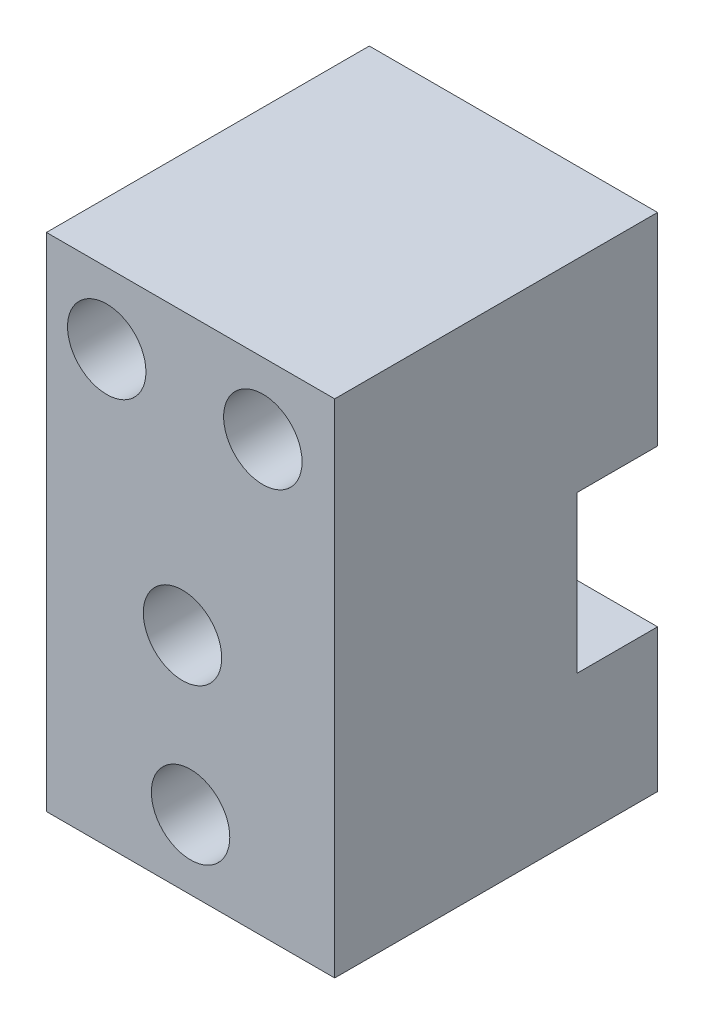
from build123d import *

# Parameters (mm, degrees)
ESQUISSE1_W             = 12.5
ESQUISSE1_H             = 21.75
BOSS_EXTRU_3_DEPTH      = 14
ESQUISSE9_W             = 10.579409941
ESQUISSE9_H             = 6.787962443
ENL_V_MAT_EXTRU_7_DEPTH = 3.5
D_GAGEMENT_M32_D        = 3.4
D_GAGEMENT_M33_D        = 3.4
ESQUISSE23_W            = 9.88556754
ESQUISSE23_H            = 6.787962443
ESQUISSE23_R            = 1.7
BOSS_EXTRU_4_DEPTH      = 3.5


with BuildPart() as part:
    # Esquisse1 → Boss.-Extru.3 (new body)
    with BuildSketch(Plane.XY):
        Rectangle(ESQUISSE1_W, ESQUISSE1_H)
    extrude(amount=BOSS_EXTRU_3_DEPTH)

    # Esquisse9 → Enlèv. mat.-Extru.7 (cut)
    with BuildSketch(Plane.XY.offset(14)):
        with Locations((1.654137431, -1.292305661)):
            Rectangle(ESQUISSE9_W, ESQUISSE9_H)
    enl_v_mat_extru_7 = extrude(amount=-ENL_V_MAT_EXTRU_7_DEPTH, mode=Mode.SUBTRACT)

    # Dégagement M32 (through all)
    with Locations(Plane.XY.offset(14)):
        with Locations((-0.35, -1.306160818)):
            Hole(D_GAGEMENT_M32_D / 2)

    # Dégagement M33 (through all)
    with Locations(Plane.XY.offset(14)):
        with Locations((-3.63556754, 7.794867284), (3.134168266, 7.794867284), (0, -7.865811289)):
            Hole(D_GAGEMENT_M33_D / 2)

    # Symétrie1: Enlèv. mat.-Extru.7 across plane
    add(enl_v_mat_extru_7.mirror(Plane.XY.offset(7)), mode=Mode.SUBTRACT)

    # Esquisse23 → Boss.-Extru.4 (add)
    with BuildSketch(Plane.XY.offset(10.5)):
        with Locations((1.30721623, -1.292305661)):
            Rectangle(ESQUISSE23_W, ESQUISSE23_H)
        with Locations(Location((-0.35, -1.306160818, 0), (0, 0, 180))):
            Circle(ESQUISSE23_R, mode=Mode.SUBTRACT)
    extrude(amount=BOSS_EXTRU_4_DEPTH)


solid = part.part
